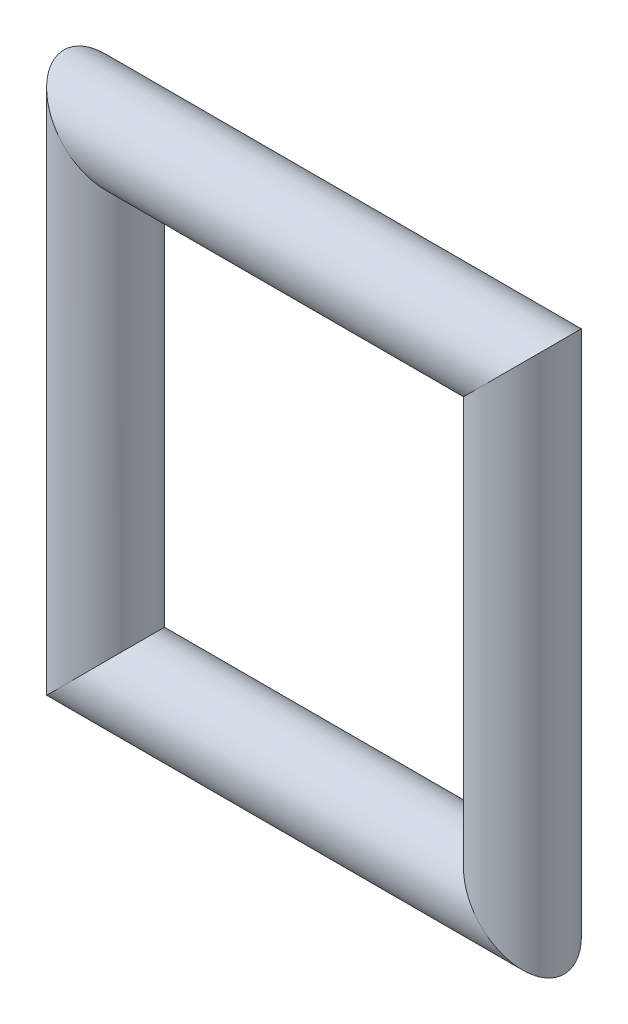
from build123d import *

# Parameters (mm, degrees)
SWEEP1_PROFILE_R = 2.5


with BuildPart() as part:
    # Sweep1: sweep along a path in Sketch1
    with BuildLine(Plane.XY) as sweep1_path:
        Line((-12.5, -14), (12.5, -14))
        Line((12.5, -14), (12.5, 14))
        Line((12.5, 14), (-12.5, 14))
        Line((-12.5, 14), (-12.5, -14))
    # Sweep1 profile (on start of the path) → Sweep1 (sweep)
    with BuildSketch(Plane(origin=(-12.5, -14, 0), x_dir=(0, 0, 1), z_dir=(1, 0, 0))):
        Circle(SWEEP1_PROFILE_R)
    sweep(path=sweep1_path.line, transition=Transition.RIGHT)


solid = part.part
